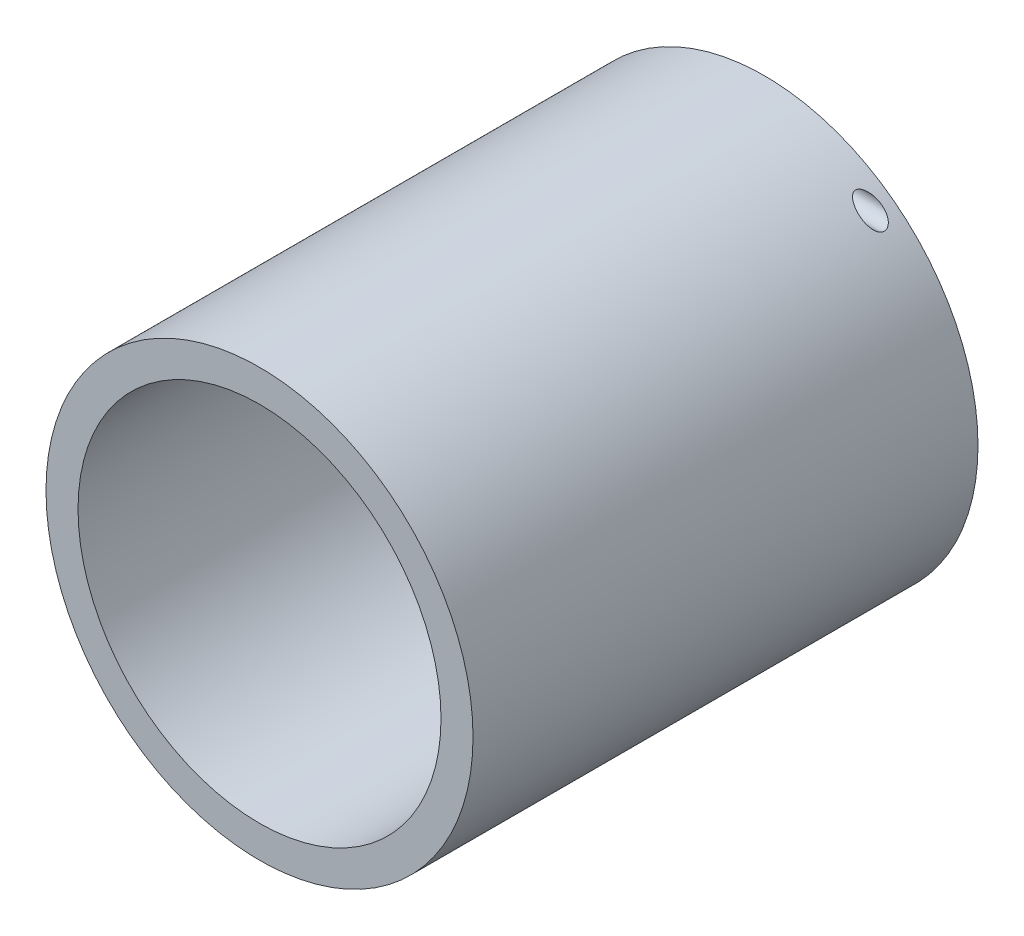
from build123d import *

# Parameters (mm, degrees)
BOSS_EXTRUDE2_DEPTH      = 25.4
BOSS_EXTRUDE2_DEPTH_BACK = 49.691143
SKETCH1_R                = 31.75
SKETCH1_R_2              = 26.9875
CUT_EXTRUDE5_REACH       = 68.973
CUT_EXTRUDE5_END_RADIUS  = 31.75
SKETCH2_R                = 1.5875


with BuildPart() as part:
    # Sketch1 → Boss-Extrude2 (new, two sides: drawn at the far end of the back side and taken through both)
    with BuildSketch(Plane.XY.offset(-BOSS_EXTRUDE2_DEPTH_BACK)):
        Circle(SKETCH1_R)
        Circle(SKETCH1_R_2, mode=Mode.SUBTRACT)
    extrude(amount=BOSS_EXTRUDE2_DEPTH + BOSS_EXTRUDE2_DEPTH_BACK)

    # Cut-Extrude5: up to this cylinder (the profile starts inside it)
    cut_extrude5_end = Plane(origin=(0, 0, -46.516143), z_dir=(0, 0, -1)) * Cylinder(CUT_EXTRUDE5_END_RADIUS, 202.446, mode=Mode.PRIVATE)
    # Sketch2 → Cut-Extrude5 (cut, up to the surface)
    with BuildSketch(Plane(origin=(0, 0, 0), x_dir=(0, 0, -1), z_dir=(1, 0, 0)), mode=Mode.PRIVATE) as cut_extrude5_sk1:
        with Locations(Location((46.516143219, 25.4, 0), (0, 0, 180))):
            Circle(SKETCH2_R)
    cut_extrude5_tool1 = extrude(cut_extrude5_sk1.sketch, amount=CUT_EXTRUDE5_REACH, mode=Mode.PRIVATE) & cut_extrude5_end
    add(cut_extrude5_tool1.solids().sort_by_distance((0, 25.4, -46.516143))[0], mode=Mode.SUBTRACT)


solid = part.part
